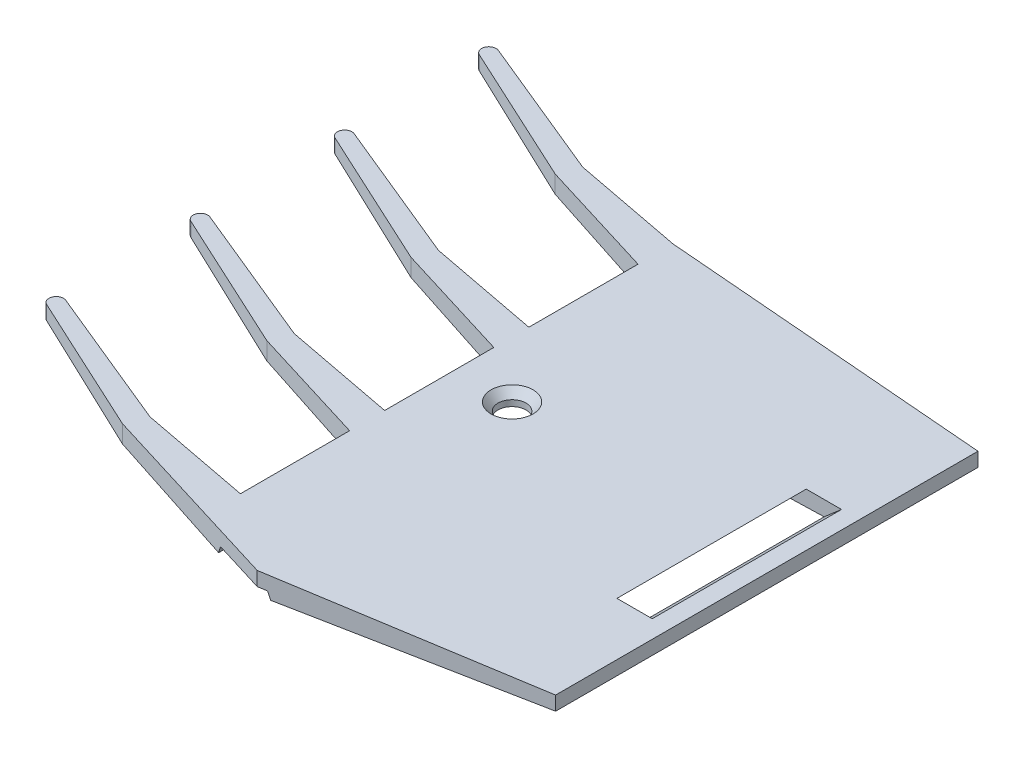
from build123d import *

# Parameters (mm, degrees)
BOSS_EXTRUDE1_START = 12
BOSS_EXTRUDE1_DEPTH = 81.818884
SKETCH1_OUTSIDE_W   = 111.208
SKETCH1_OUTSIDE_H   = 107.499
CUT_EXTRUDE1_DEPTH  = 86.261649485
CUT_EXTRUDE2_START  = -37.210696
CUT_EXTRUDE2_DEPTH  = 27
SKETCH5_R           = 2
CUT_EXTRUDE4_DEPTH  = 85.8164494


with BuildPart() as part:
    # Sketch2 → Boss-Extrude1 (new body)
    with BuildSketch(Plane.XY.offset(BOSS_EXTRUDE1_START)):
        Polygon((-48.8453919, -1.977444406), (-7.943168155, -3), (-7.569819885, -2), (1.280407352, -2), (1.653755621, -3), (36.682523305, -2), (36.682523305, 0), (-48.8453919, 0), align=None)
    extrude(amount=-BOSS_EXTRUDE1_DEPTH)

    # Sketch1 outside → Cut-Extrude1 (cut, through all)
    with BuildSketch(Plane(origin=(0, 0, 0), x_dir=(1, 0, 0), z_dir=(0, 1, 0))):
        with Locations((-6.081, 28.9095)):
            Rectangle(SKETCH1_OUTSIDE_W, SKETCH1_OUTSIDE_H)
        with BuildLine():
            Line((-27.718637693, -3.492120904), (0, -12))
            Line((0, -12), (36.682523305, -6.114423246))
            Line((36.682523305, -6.114423246), (36.682523305, 54.145919103))
            Line((36.682523305, 54.145919103), (-10.674216271, 58))
            Line((-10.674216271, 58), (-26.6233986, 61.050643653))
            Line((-26.6233986, 61.050643653), (-47.053769098, 69.453098724))
            ThreePointArc((-47.053769098, 69.453098724), (-48.393579381, 68.911077159), (-47.880590401, 67.559884621))
            Line((-47.880590401, 67.559884621), (-27.718637693, 58.23156579))
            Line((-27.718637693, 58.23156579), (-10.674216271, 53))
            Line((-10.674216271, 53), (-10.674216271, 37.425437768))
            Line((-10.674216271, 37.425437768), (-26.6233986, 40.476081421))
            Line((-26.6233986, 40.476081421), (-47.053769098, 48.878536493))
            ThreePointArc((-47.053769098, 48.878536493), (-48.393579381, 48.336514928), (-47.880590401, 46.985322389))
            Line((-47.880590401, 46.985322389), (-27.718637693, 37.657003559))
            Line((-27.718637693, 37.657003559), (-10.674216271, 32.425437768))
            Line((-10.674216271, 32.425437768), (-10.674216271, 16.850875537))
            Line((-10.674216271, 16.850875537), (-26.6233986, 19.90151919))
            Line((-26.6233986, 19.90151919), (-47.053769098, 28.303974261))
            ThreePointArc((-47.053769098, 28.303974261), (-48.393579381, 27.761952696), (-47.880590401, 26.410760157))
            Line((-47.880590401, 26.410760157), (-27.718637693, 17.082441327))
            Line((-27.718637693, 17.082441327), (-10.674216271, 11.850875537))
            Line((-10.674216271, 11.850875537), (-10.674216271, -3.723686695))
            Line((-10.674216271, -3.723686695), (-26.6233986, -0.673043042))
            Line((-26.6233986, -0.673043042), (-47.053769098, 7.729412029))
            ThreePointArc((-47.053769098, 7.729412029), (-48.393579381, 7.187390465), (-47.880590401, 5.836197926))
            Line((-47.880590401, 5.836197926), (-27.718637693, -3.492120904))
        make_face(mode=Mode.SUBTRACT)
    extrude(amount=-CUT_EXTRUDE1_DEPTH, mode=Mode.SUBTRACT)

    # Sketch3 → Cut-Extrude2 (cut)
    with BuildSketch(Plane.XY.offset(CUT_EXTRUDE2_START)):
        Polygon((34.143841834, 0), (29.113394238, 0), (26.332255745, -2.295479066), (31.673105241, -2.143008687), align=None)
    extrude(amount=CUT_EXTRUDE2_DEPTH, mode=Mode.SUBTRACT)

    # Cut-Extrude3 cone 1 section (through the dimple's axis) → Cut-Extrude3 (revolve, cut)
    with BuildSketch(Plane(origin=(-2.644706267, 0, -27), x_dir=(0, 0, 1), z_dir=(1, 0, 0))):
        Polygon((0, 0), (2.9924, 0), (0, 3.442362422), align=None)
    revolve(axis=Axis((-2.644706267, 0, -27), (0, -1, 0)), mode=Mode.SUBTRACT)

    # Sketch5 → Cut-Extrude4 (cut, through all)
    with BuildSketch(Plane(origin=(0, 0, 0), x_dir=(1, 0, 0), z_dir=(0, 1, 0))):
        with Locations(Location((-2.644706267, 27, 0), (0, 0, 270))):
            Circle(SKETCH5_R)
    extrude(amount=-CUT_EXTRUDE4_DEPTH, mode=Mode.SUBTRACT)


solid = part.part
